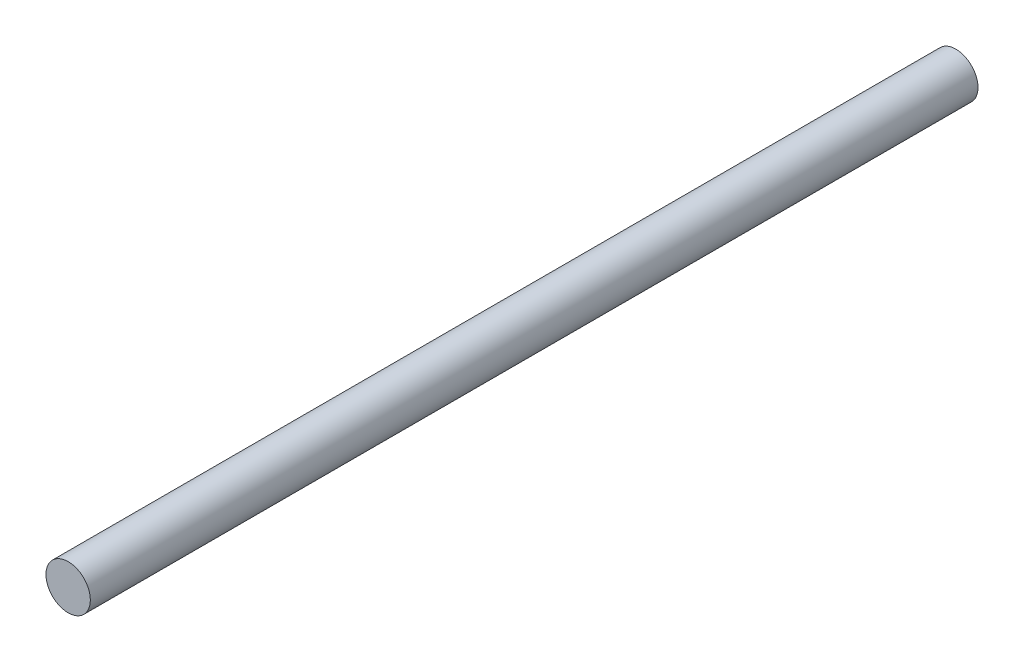
from build123d import *

# Parameters (mm, degrees)
SKETCH1_R           = 0.75
BOSS_EXTRUDE1_DEPTH = 30


with BuildPart() as part:
    # Sketch1 → Boss-Extrude1 (new body)
    with BuildSketch(Plane.XY):
        Circle(SKETCH1_R)
    extrude(amount=BOSS_EXTRUDE1_DEPTH)


solid = part.part
